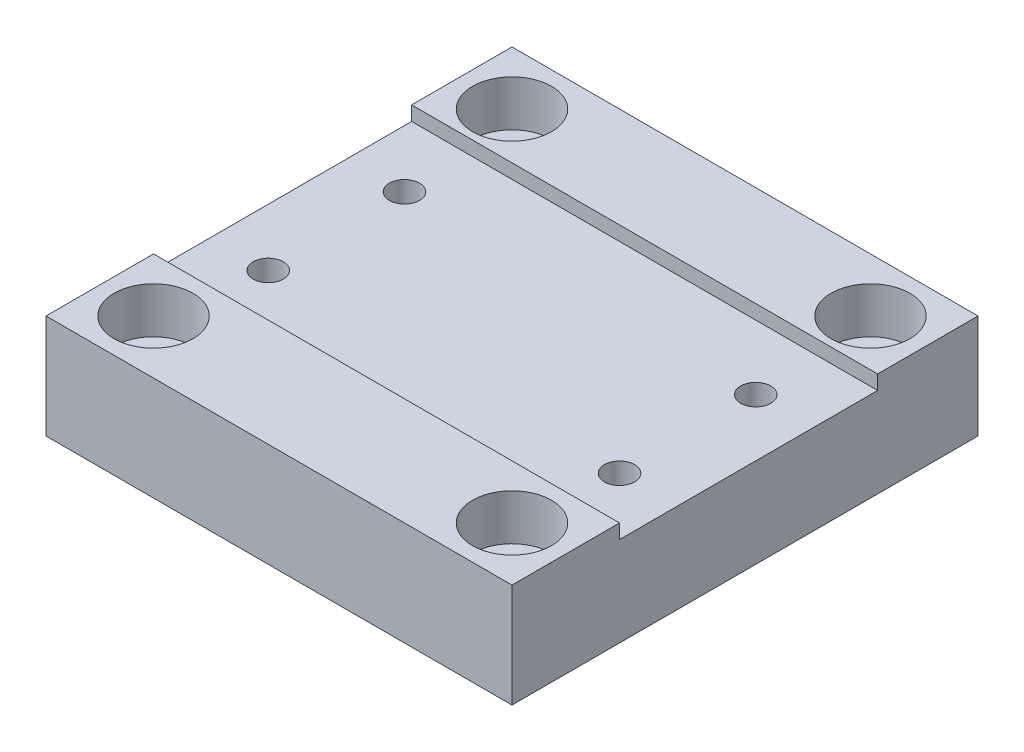
from build123d import *

# Parameters (mm, degrees)
SKIZZE1_W                                            = 65
SKIZZE1_H                                            = 65
AUFSATZ_LINEAR_AUSTRAGEN1_DEPTH                      = 14.5
STIRNSENKUNG_F_R_M6_ZYLINDERSCHRAUBE_MIT_D           = 6.6
STIRNSENKUNG_F_R_M6_ZYLINDERSCHRAUBE_MIT_CBORE_D     = 11
STIRNSENKUNG_F_R_M6_ZYLINDERSCHRAUBE_MIT_CBORE_DEPTH = 6.4
SKIZZE8_W                                            = 65
SKIZZE8_H                                            = 36
SCHNITT_LINEAR_AUSTRAGEN1_DEPTH                      = 2
KERNLOCH_F_R_M5_GEWINDE1_D                           = 4.2


with BuildPart() as part:
    # Skizze1 → Aufsatz-Linear austragen1 (new body)
    with BuildSketch(Plane(origin=(0, 0, 0), x_dir=(1, 0, 0), z_dir=(0, 1, 0))):
        Rectangle(SKIZZE1_W, SKIZZE1_H)
    extrude(amount=AUFSATZ_LINEAR_AUSTRAGEN1_DEPTH)

    # Stirnsenkung für M6 Zylinderschraube mit Innensechskant1 (through all)
    with Locations(Plane(origin=(0, 14.5, 0), x_dir=(1, 0, 0), z_dir=(0, 1, 0))):
        with Locations((-25, -25), (-25, 25), (25, 25), (25, -25)):
            CounterBoreHole(STIRNSENKUNG_F_R_M6_ZYLINDERSCHRAUBE_MIT_D / 2, STIRNSENKUNG_F_R_M6_ZYLINDERSCHRAUBE_MIT_CBORE_D / 2, STIRNSENKUNG_F_R_M6_ZYLINDERSCHRAUBE_MIT_CBORE_DEPTH)

    # Skizze8 → Schnitt-Linear austragen1 (cut)
    with BuildSketch(Plane(origin=(0, 14.5, 0), x_dir=(1, 0, 0), z_dir=(0, 1, 0))):
        with Locations((0, 0.5)):
            Rectangle(SKIZZE8_W, SKIZZE8_H)
    extrude(amount=-SCHNITT_LINEAR_AUSTRAGEN1_DEPTH, mode=Mode.SUBTRACT)

    # Kernloch für M5 Gewinde1 (through all)
    with Locations(Plane(origin=(61.744554923, 12.5, 78.125902763), x_dir=(0, 0, 1), z_dir=(0, 1, 0))):
        with Locations((-68.625902763, -37.244554923), (-87.625902763, -37.244554923), (-87.625902763, -86.244554923), (-68.625902763, -86.244554923)):
            Hole(KERNLOCH_F_R_M5_GEWINDE1_D / 2)


solid = part.part
